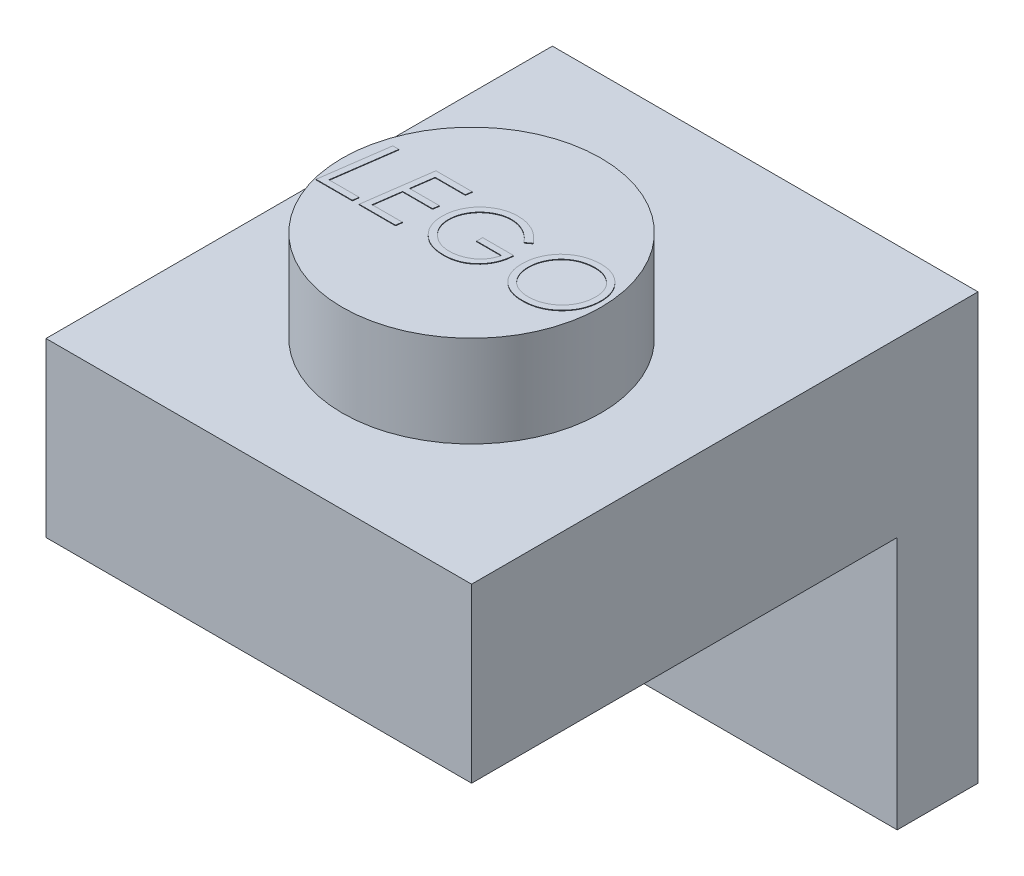
from build123d import *

# Parameters (mm, degrees)
SKETCH1_W           = 7.9
SKETCH1_H           = 7.9
BOSS_EXTRUDE1_DEPTH = 3.2
SKETCH2_R           = 2.4
BOSS_EXTRUDE2_DEPTH = 1.7
BOSS_EXTRUDE4_DEPTH = 0.01
SKETCH4_W           = 6.679581062
SKETCH4_H           = 6.679581062
CUT_EXTRUDE1_DEPTH  = 2.01
BOSS_EXTRUDE5_START = -2.01
BOSS_EXTRUDE5_DEPTH = 2.01
SKETCH6_W           = 7.9
SKETCH6_H           = 7.9
BOSS_EXTRUDE6_DEPTH = 1.5
SKETCH7_R           = 2.4
BOSS_EXTRUDE7_DEPTH = 1.4
SKETCH8_R           = 1.690060404
CUT_EXTRUDE2_DEPTH  = 1.4


with BuildPart() as part:
    # Sketch1 → Boss-Extrude1 (new body)
    with BuildSketch(Plane(origin=(0, 0, 0), x_dir=(1, 0, 0), z_dir=(0, 1, 0))):
        with Locations((3.95, 3.95)):
            Rectangle(SKETCH1_W, SKETCH1_H)
    extrude(amount=BOSS_EXTRUDE1_DEPTH)

    # Sketch2 → Boss-Extrude2 (add)
    with BuildSketch(Plane(origin=(0, 3.2, 0), x_dir=(1, 0, 0), z_dir=(0, 1, 0))):
        with Locations(Location((3.95, 3.95, 0), (0, 0, 270))):
            Circle(SKETCH2_R)
    extrude(amount=BOSS_EXTRUDE2_DEPTH)

    # Sketch3 → Boss-Extrude4 (add)
    # profile 1 of 4: a face of its own
    with BuildSketch(Plane(origin=(0, 4.9, 0), x_dir=(1, 0, 0), z_dir=(0, 1, 0))):
        Polygon((1.832282536, 4.604898123), (1.945463626, 4.604898123), (1.785708017, 3.46707761), (2.346104652, 3.46707761), (2.331831815, 3.354898123), (1.657002088, 3.354898123), align=None)
    # profile 2 of 4: a face of its own
    with BuildSketch(Plane(origin=(0, 4.9, 0), x_dir=(1, 0, 0), z_dir=(0, 1, 0))):
        Polygon((3.307643113, 4.604898123), (3.289864668, 4.492718636), (2.730720036, 4.492718636), (2.672376687, 4.076051969), (3.227514908, 4.076051969), (3.211489267, 3.963872482), (2.656351046, 3.963872482), (2.586990069, 3.46707761), (3.147386703, 3.46707761), (3.132863466, 3.354898123), (2.458284139, 3.354898123), (2.633564588, 4.604898123), align=None)
    # profile 3 of 4: a face of its own
    with BuildSketch(Plane(origin=(0, 4.9, 0), x_dir=(1, 0, 0), z_dir=(0, 1, 0))):
        with BuildLine():
            Line((4.701873883, 4.341727049), (4.602214428, 4.268359661))
            add(Edge.make_bspline(
                [(4.602214428, 4.268359661), (4.594223081, 4.278463296), (4.578382454, 4.298490949), (4.552974208, 4.326751799), (4.526781942, 4.353389692), (4.49925824, 4.377917229), (4.471083571, 4.40112998), (4.441525281, 4.42204341), (4.410978563, 4.441207159), (4.379659496, 4.458649755), (4.347610579, 4.474125482), (4.315396207, 4.487732834), (4.282869127, 4.498922357), (4.250283005, 4.50864136), (4.217299487, 4.51587276), (4.18414763, 4.520710487), (4.150903008, 4.524293062), (4.128633082, 4.524610402), (4.117438786, 4.524769918)],
                knots=[0, 0, 0, 0, 1.088205139, 2.157064813, 3.209299296, 4.24303109, 5.270682624, 6.292193363, 7.299904734, 8.316436989, 9.319473328, 10.305733085, 11.269264382, 12.22444877, 13.177574148, 14.119122834, 15.054550362, 16, 16, 16, 16], degree=3))
            add(Edge.make_bspline(
                [(4.117438786, 4.524769918), (4.104994375, 4.524521107), (4.080132736, 4.524024028), (4.043033101, 4.520256885), (4.006376299, 4.51354748), (3.969908323, 4.504926578), (3.933893833, 4.493301772), (3.898252767, 4.479273564), (3.86309309, 4.462612711), (3.828430169, 4.443710217), (3.794953431, 4.422557236), (3.762954424, 4.399818018), (3.733183783, 4.375017311), (3.704650221, 4.34913067), (3.678490591, 4.320990985), (3.654040353, 4.291325456), (3.631570613, 4.259970376), (3.610753816, 4.22729124), (3.592321888, 4.193377608), (3.576332398, 4.158696131), (3.562301633, 4.123622124), (3.551463822, 4.087613068), (3.542488613, 4.051135011), (3.536702509, 4.013925289), (3.532682003, 3.976230124), (3.532229884, 3.950862463), (3.532002088, 3.938081216)],
                knots=[0, 0, 0, 0, 0.97704485, 1.95195533, 2.923843304, 3.901415526, 4.89212417, 5.89249681, 6.906854198, 7.94508701, 8.99059592, 10.014519948, 11.024825533, 12.031297736, 13.037428488, 14.038509295, 15.047964276, 16.064309815, 17.079005887, 18.075937854, 19.061713623, 20.042247028, 21.026191147, 22.008802999, 22.996754876, 24, 24, 24, 24], degree=3))
            add(Edge.make_bspline(
                [(3.532002088, 3.938081216), (3.532369323, 3.920940483), (3.533092921, 3.887166428), (3.54080397, 3.83756171), (3.552297071, 3.789703796), (3.569345009, 3.743984102), (3.590663785, 3.700113704), (3.616898701, 3.658340736), (3.647995923, 3.618632516), (3.683169388, 3.581124089), (3.721975609, 3.547190184), (3.762989457, 3.517071082), (3.806208637, 3.491553815), (3.851780792, 3.471217023), (3.899058754, 3.454481236), (3.948703848, 3.443615036), (4.000192874, 3.436168993), (4.035279814, 3.435410998), (4.053085822, 3.435026328)],
                knots=[0, 0, 0, 0, 1.019699772, 2.00921373, 2.981850619, 3.945611549, 4.907936516, 5.881372837, 6.876399243, 7.906447893, 8.938173367, 9.941073143, 10.932270214, 11.919723139, 12.908225854, 13.912405215, 14.940582182, 16, 16, 16, 16], degree=3))
            add(Edge.make_bspline(
                [(4.053085822, 3.435026328), (4.074581254, 3.435599426), (4.11748625, 3.436743331), (4.180872469, 3.447608002), (4.243162184, 3.464003995), (4.303115661, 3.48756372), (4.359892332, 3.516274774), (4.411741714, 3.54979345), (4.457784869, 3.587961635), (4.498384943, 3.630580026), (4.53303885, 3.678554542), (4.563120551, 3.731230233), (4.587740602, 3.789373269), (4.599634966, 3.830601123), (4.605720036, 3.851692995)],
                knots=[0, 0, 0, 0, 1.033792167, 2.063454529, 3.086685911, 4.12966393, 5.157365104, 6.144632769, 7.094686579, 8.02963692, 8.969786061, 9.935985671, 10.944065236, 12, 12, 12, 12], degree=3))
            Line((4.605720036, 3.851692995), (4.140976447, 3.851692995))
            Line((4.140976447, 3.851692995), (4.140976447, 3.963872482))
            Line((4.140976447, 3.963872482), (4.717899524, 3.963872482))
            add(Edge.make_bspline(
                [(4.717899524, 3.963872482), (4.715864452, 3.940537279), (4.711874195, 3.894782885), (4.69942647, 3.828086612), (4.68199329, 3.764774229), (4.659173945, 3.704861641), (4.630919519, 3.648505742), (4.59774963, 3.595348644), (4.559285746, 3.545571633), (4.515814341, 3.499721655), (4.46844757, 3.458302738), (4.417878433, 3.421925394), (4.364351012, 3.391393009), (4.308182236, 3.366007973), (4.248908241, 3.346854494), (4.187007442, 3.33278705), (4.12217798, 3.324364805), (4.078067373, 3.323359246), (4.055589828, 3.322846841)],
                knots=[0, 0, 0, 0, 1.098006248, 2.152910829, 3.176693714, 4.174102283, 5.154427425, 6.128677043, 7.108165613, 8.099464247, 9.087077226, 10.054952015, 11.015803916, 11.972468591, 12.940477937, 13.931877037, 14.946141749, 16, 16, 16, 16], degree=3))
            add(Edge.make_bspline(
                [(4.055589828, 3.322846841), (4.032525547, 3.323342362), (3.987411429, 3.324311611), (3.9214857, 3.332876212), (3.858807865, 3.34620412), (3.799404334, 3.365318809), (3.743277296, 3.389857102), (3.690679177, 3.420179827), (3.641268759, 3.455657405), (3.595689928, 3.496348401), (3.554559756, 3.541197331), (3.518567584, 3.589307242), (3.487743642, 3.639999747), (3.462901044, 3.693721351), (3.443468533, 3.750181555), (3.429856098, 3.809437188), (3.421311108, 3.871476007), (3.420325278, 3.913764014), (3.419822601, 3.935326809)],
                knots=[0, 0, 0, 0, 1.117903688, 2.186638197, 3.21780727, 4.221242465, 5.20706516, 6.182431358, 7.159609539, 8.151436913, 9.139682433, 10.10533578, 11.060397566, 12.011007066, 12.969638005, 13.950363306, 14.954883424, 16, 16, 16, 16], degree=3))
            add(Edge.make_bspline(
                [(3.419822601, 3.935326809), (3.420138952, 3.950859376), (3.420767729, 3.981731803), (3.424963713, 4.027616327), (3.432679126, 4.072646659), (3.442852825, 4.116910735), (3.455965552, 4.160496846), (3.471933961, 4.20328178), (3.491087489, 4.245242481), (3.513047729, 4.286115161), (3.537530339, 4.325600602), (3.564271155, 4.363247138), (3.593498243, 4.398542313), (3.624507556, 4.432098501), (3.658146201, 4.463054417), (3.693847346, 4.491888255), (3.731480716, 4.518905381), (3.77142415, 4.543221398), (3.812846375, 4.565137356), (3.855118915, 4.584605211), (3.898469674, 4.600573637), (3.942428974, 4.613905323), (3.987291028, 4.624144078), (4.032916476, 4.631801844), (4.079465257, 4.63599767), (4.110753822, 4.636631416), (4.12645321, 4.636949405)],
                knots=[0, 0, 0, 0, 1.01034602, 2.008157081, 2.993527994, 3.979930372, 4.960683832, 5.951959865, 6.948100503, 7.958563211, 8.967975239, 9.968308804, 10.959584837, 11.946808627, 12.938010319, 13.930059161, 14.930392727, 15.949048275, 16.969091794, 17.977364349, 18.973726886, 19.971641333, 20.963333569, 21.964771492, 22.978801278, 24, 24, 24, 24], degree=3))
            add(Edge.make_bspline(
                [(4.12645321, 4.636949405), (4.140647989, 4.63666956), (4.168739982, 4.636115737), (4.210476499, 4.63288549), (4.251380819, 4.627152534), (4.29129634, 4.618801418), (4.330484053, 4.608567941), (4.368675988, 4.59577053), (4.406070924, 4.580754735), (4.442474857, 4.563343269), (4.478143584, 4.543914061), (4.512619765, 4.521658579), (4.546625807, 4.497640881), (4.579591338, 4.471153536), (4.611552577, 4.442077414), (4.642675265, 4.410871755), (4.673242279, 4.377555225), (4.692243855, 4.353777591), (4.701873883, 4.341727049)],
                knots=[0, 0, 0, 0, 1.015105213, 2.008930748, 2.991454354, 3.966534974, 4.923490216, 5.886087319, 6.844809209, 7.803252371, 8.770243484, 9.747130909, 10.735853235, 11.746297741, 12.768902994, 13.824016992, 14.897208497, 16, 16, 16, 16], degree=3))
        make_face()
    # profile 4 of 4: a face of its own
    with BuildSketch(Plane(origin=(0, 4.9, 0), x_dir=(1, 0, 0), z_dir=(0, 1, 0))):
        with BuildLine():
            add(Edge.make_bspline(
                [(5.671925966, 4.636949405), (5.692400623, 4.63650345), (5.732667893, 4.635626396), (5.791703582, 4.627669814), (5.84816478, 4.614697282), (5.901922783, 4.596339067), (5.953136821, 4.572927607), (6.001690741, 4.544284414), (6.047399306, 4.510158163), (6.09025375, 4.471611385), (6.129154607, 4.429051867), (6.163160058, 4.383201547), (6.192058383, 4.334734533), (6.215910086, 4.283554512), (6.233823478, 4.229366588), (6.246743033, 4.172603876), (6.255145963, 4.113110877), (6.255950492, 4.072491917), (6.256361062, 4.051763107)],
                knots=[0, 0, 0, 0, 1.061681398, 2.087996504, 3.083659545, 4.062660971, 5.02945529, 5.999994507, 6.981138296, 7.983640916, 8.985844288, 9.966988076, 10.939736476, 11.908342154, 12.890058995, 13.894159216, 14.925339913, 16, 16, 16, 16], degree=3))
            add(Edge.make_bspline(
                [(6.256361062, 4.051763107), (6.25623821, 4.038988627), (6.255995471, 4.01374805), (6.253408976, 3.976225127), (6.249128591, 3.939561124), (6.243455349, 3.903597875), (6.235835613, 3.868539787), (6.226924527, 3.834140064), (6.216051359, 3.800598383), (6.20384118, 3.767696929), (6.189792262, 3.735595516), (6.173946521, 3.704324105), (6.15669213, 3.673663515), (6.137607818, 3.643838863), (6.11686312, 3.614849105), (6.094393683, 3.586665409), (6.070489857, 3.559187301), (6.044887258, 3.532733386), (6.018336956, 3.507212599), (5.990529993, 3.48355884), (5.962091012, 3.461350566), (5.932834084, 3.440746086), (5.90250067, 3.422121085), (5.871581935, 3.404690573), (5.839905885, 3.388861691), (5.807185809, 3.375183309), (5.773789823, 3.362832151), (5.739620564, 3.352089492), (5.704582969, 3.343076229), (5.668762424, 3.335500733), (5.632062087, 3.329787275), (5.594535036, 3.325855801), (5.556279304, 3.323200874), (5.530454147, 3.322965537), (5.51742877, 3.322846841)],
                knots=[0, 0, 0, 0, 1.057694632, 2.089855924, 3.112648636, 4.113725536, 5.103331559, 6.082381806, 7.055068159, 8.021768845, 8.98743121, 9.954922249, 10.923671581, 11.89959402, 12.885451751, 13.874212627, 14.883322035, 15.900071676, 16.921812937, 17.931632203, 18.921551953, 19.909055848, 20.892997665, 21.867769094, 22.84762411, 23.823252803, 24.802912784, 25.795362855, 26.787788858, 27.797679081, 28.826061376, 29.861826465, 30.921574152, 32, 32, 32, 32], degree=3))
            add(Edge.make_bspline(
                [(5.51742877, 3.322846841), (5.495540081, 3.323312388), (5.45279647, 3.324221496), (5.390401025, 3.331753811), (5.331466149, 3.34468508), (5.275615882, 3.361975519), (5.223270197, 3.38492417), (5.174339628, 3.412892082), (5.128783581, 3.445910526), (5.086763869, 3.483632016), (5.049135515, 3.525626819), (5.016044394, 3.570822838), (4.988418107, 3.619388761), (4.96538613, 3.670881503), (4.948106883, 3.725740589), (4.935156589, 3.783416472), (4.927613141, 3.844314319), (4.926699871, 3.88597706), (4.926232857, 3.907281937)],
                knots=[0, 0, 0, 0, 1.121422378, 2.189881799, 3.214223923, 4.209829567, 5.180887389, 6.136870002, 7.092517675, 8.058664933, 9.02481219, 9.976998316, 10.923432162, 11.882748215, 12.86205079, 13.865508147, 14.908495107, 16, 16, 16, 16], degree=3))
            add(Edge.make_bspline(
                [(4.926232857, 3.907281937), (4.92651465, 3.92390256), (4.927073619, 3.956871533), (4.931757127, 4.005792823), (4.939128338, 4.053761359), (4.950024433, 4.100549976), (4.963594459, 4.14639076), (4.979990494, 4.191253803), (5.000003008, 4.234848241), (5.022452359, 4.277389438), (5.047513645, 4.318359564), (5.07559856, 4.356880644), (5.105216605, 4.393691441), (5.137816677, 4.42780852), (5.172496353, 4.459796588), (5.209524734, 4.489546335), (5.248906172, 4.516814917), (5.290422211, 4.541753927), (5.333531205, 4.564369022), (5.378335052, 4.583562961), (5.424193072, 4.600182058), (5.471345954, 4.613795807), (5.519847317, 4.623918047), (5.569406413, 4.631466127), (5.620254649, 4.636113027), (5.6545551, 4.636668231), (5.671925966, 4.636949405)],
                knots=[0, 0, 0, 0, 1.027038055, 2.037251559, 3.03463374, 4.024476576, 5.003805404, 5.987972729, 6.973761106, 7.966047439, 8.95963362, 9.938921687, 10.910571097, 11.877553313, 12.852319973, 13.824735949, 14.81069978, 15.81041387, 16.816403723, 17.816876174, 18.82042938, 19.829469955, 20.847307225, 21.880377804, 22.926554263, 24, 24, 24, 24], degree=3))
        make_face()
        with BuildLine():
            add(Edge.make_bspline(
                [(5.671925966, 4.524769918), (5.65697579, 4.524545747), (5.627444828, 4.524102944), (5.583747158, 4.520086709), (5.541191397, 4.514393729), (5.499970629, 4.505322476), (5.459846772, 4.494612055), (5.421182876, 4.480527241), (5.383524652, 4.464643931), (5.34726264, 4.446055377), (5.312516644, 4.425361321), (5.279529586, 4.402463835), (5.248469657, 4.377453479), (5.219370347, 4.350164922), (5.191739723, 4.321307483), (5.166361885, 4.289965789), (5.142845474, 4.256628787), (5.121196386, 4.221501346), (5.10164712, 4.185107003), (5.08492909, 4.147719282), (5.070612165, 4.109847114), (5.058744989, 4.071497155), (5.049737471, 4.032481304), (5.043287884, 3.99291855), (5.039049877, 3.95269661), (5.03862585, 3.92565532), (5.038412344, 3.912039549)],
                knots=[0, 0, 0, 0, 1.093710758, 2.16039807, 3.20900896, 4.233234191, 5.246749975, 6.245527847, 7.241594159, 8.235879922, 9.224691631, 10.198908654, 11.171861231, 12.139893662, 13.116290872, 14.093089164, 15.087825051, 16.099756899, 17.110766713, 18.108591704, 19.094380672, 20.071961556, 21.043859171, 22.021859724, 23.00397114, 24, 24, 24, 24], degree=3))
            add(Edge.make_bspline(
                [(5.038412344, 3.912039549), (5.038625982, 3.900599914), (5.039049193, 3.877938292), (5.041777549, 3.844392517), (5.046595514, 3.811801965), (5.053065301, 3.780081073), (5.061542906, 3.749273697), (5.072183234, 3.719394567), (5.084405544, 3.690349568), (5.098393626, 3.662290632), (5.114175341, 3.635553687), (5.131389377, 3.61020951), (5.150226394, 3.586682218), (5.170360361, 3.564729612), (5.191972025, 3.544421151), (5.214980987, 3.52555365), (5.239648771, 3.508615875), (5.265465573, 3.492943288), (5.292687864, 3.479247808), (5.321165948, 3.467438697), (5.350786278, 3.457432665), (5.381544214, 3.449135171), (5.413524888, 3.442928532), (5.44663118, 3.438448028), (5.480905707, 3.435639812), (5.504152208, 3.435232585), (5.515926367, 3.435026328)],
                knots=[0, 0, 0, 0, 1.083699529, 2.146780792, 3.185591126, 4.202843058, 5.211856999, 6.209655863, 7.20532214, 8.195415879, 9.177202942, 10.14436246, 11.095191523, 12.029705806, 12.963818608, 13.902338257, 14.845476191, 15.796042213, 16.761390084, 17.729066592, 18.714222808, 19.721158958, 20.74459932, 21.797962164, 22.884686177, 24, 24, 24, 24], degree=3))
            add(Edge.make_bspline(
                [(5.515926367, 3.435026328), (5.530044188, 3.435228857), (5.558004277, 3.435629962), (5.599524853, 3.440000997), (5.64032433, 3.445959686), (5.680325762, 3.455225454), (5.71965402, 3.466535035), (5.757982705, 3.481070895), (5.795756024, 3.497476377), (5.83237428, 3.51683082), (5.867802238, 3.538111172), (5.901266528, 3.561837848), (5.932774032, 3.587459191), (5.962816859, 3.614626895), (5.990234918, 3.644356353), (6.016009711, 3.675809964), (6.039684501, 3.709331455), (6.061465654, 3.744601276), (6.080935982, 3.781209824), (6.097718361, 3.818903041), (6.112024773, 3.857287248), (6.123844079, 3.896320217), (6.132886835, 3.936161865), (6.139301688, 3.976648339), (6.14355343, 4.017951988), (6.143970816, 4.04574289), (6.144181575, 4.059775927)],
                knots=[0, 0, 0, 0, 1.029812959, 2.039525905, 3.043952503, 4.036919093, 5.033391511, 6.027870106, 7.026035071, 8.036794627, 9.047957848, 10.039952554, 11.027355318, 12.010276797, 12.992858524, 13.975534638, 14.976019862, 15.985163142, 16.99876328, 17.999396818, 18.993875413, 19.986244033, 20.973271002, 21.972624612, 22.976275263, 24, 24, 24, 24], degree=3))
            add(Edge.make_bspline(
                [(6.144181575, 4.059775927), (6.143688983, 4.077993105), (6.142724583, 4.113658826), (6.13551886, 4.16576722), (6.122807184, 4.214771606), (6.105892747, 4.261149785), (6.083400704, 4.304354629), (6.056090597, 4.344736825), (6.024020374, 4.382453222), (5.999069145, 4.404451295), (5.986429171, 4.415595238)],
                knots=[0, 0, 0, 0, 1.085318323, 2.124844004, 3.126009127, 4.096923137, 5.060061729, 6.020100862, 6.997008382, 8, 8, 8, 8], degree=3))
            add(Edge.make_bspline(
                [(5.986429171, 4.415595238), (5.97539623, 4.42431843), (5.953439426, 4.44167857), (5.917982347, 4.463870828), (5.881057133, 4.482788681), (5.842389242, 4.498145486), (5.802091847, 4.510165945), (5.760106575, 4.518646998), (5.716539836, 4.523741692), (5.686963766, 4.524423338), (5.671925966, 4.524769918)],
                knots=[0, 0, 0, 0, 0.992364662, 1.974918139, 2.947382948, 3.917989177, 4.907989082, 5.912266894, 6.938502841, 8, 8, 8, 8], degree=3))
        make_face(mode=Mode.SUBTRACT)
    extrude(amount=BOSS_EXTRUDE4_DEPTH)

    # Sketch4 → Cut-Extrude1 (cut)
    with BuildSketch(Plane.XZ):
        with Locations((3.960209469, -3.960209469)):
            Rectangle(SKETCH4_W, SKETCH4_H)
    extrude(amount=-CUT_EXTRUDE1_DEPTH, mode=Mode.SUBTRACT)

    # Sketch5 → Boss-Extrude5 (add)
    with BuildSketch(Plane(origin=(0, 3.2, 0), x_dir=(1, 0, 0), z_dir=(0, 1, 0)).offset(BOSS_EXTRUDE5_START)):
        with BuildLine():
            Line((6.369527619, 1.557811677), (5.363437843, 1.557811677))
            ThreePointArc((5.363437843, 1.557811677), (6.369527619, 0.551721901), (7.375617394, 1.557811677))
            ThreePointArc((7.375617394, 1.557811677), (7.080940521, 2.269224579), (6.369527619, 2.563901452))
            Line((6.369527619, 2.563901452), (6.369527619, 1.557811677))
        make_face()
        with BuildLine():
            Line((1.458127833, 2.579758881), (1.458127833, 1.557811677))
            Line((1.458127833, 1.557811677), (2.480075037, 1.557811677))
            ThreePointArc((2.480075037, 1.557811677), (2.180753631, 2.280437475), (1.458127833, 2.579758881))
        make_face()
        with BuildLine():
            Line((2.480075037, 1.557811677), (1.458127833, 1.557811677))
            Line((1.458127833, 1.557811677), (1.458127833, 2.579758881))
            ThreePointArc((1.458127833, 2.579758881), (0.735502035, 0.835185879), (2.480075037, 1.557811677))
        make_face()
        with BuildLine():
            ThreePointArc((5.605437996, 2.21232194), (5.425875301, 1.906719887), (5.363437843, 1.557811677))
            Line((5.363437843, 1.557811677), (6.369527619, 1.557811677))
            Line((6.369527619, 1.557811677), (6.369527619, 2.563901452))
            ThreePointArc((6.369527619, 2.563901452), (6.015263465, 2.499466361), (5.706377057, 2.31441459))
            ThreePointArc((5.706377057, 2.31441459), (5.656671092, 2.262613327), (5.605437996, 2.21232194))
        make_face()
        with BuildLine():
            ThreePointArc((7.385597221, 6.365232327), (6.369527619, 7.381301929), (5.353458016, 6.365232327))
            Line((5.353458016, 6.365232327), (6.369527619, 6.365232327))
            Line((6.369527619, 6.365232327), (6.369527619, 5.349162725))
            ThreePointArc((6.369527619, 5.349162725), (7.087997324, 5.646762621), (7.385597221, 6.365232327))
        make_face()
        with BuildLine():
            Line((6.369527619, 6.365232327), (5.353458016, 6.365232327))
            ThreePointArc((5.353458016, 6.365232327), (5.651057913, 5.646762621), (6.369527619, 5.349162725))
            Line((6.369527619, 5.349162725), (6.369527619, 6.365232327))
        make_face()
        with BuildLine():
            ThreePointArc((2.499242709, 6.365232327), (0.721948444, 7.101411716), (1.458127833, 5.324117451))
            Line((1.458127833, 5.324117451), (1.458127833, 6.365232327))
            Line((1.458127833, 6.365232327), (2.499242709, 6.365232327))
        make_face()
        with BuildLine():
            Line((1.458127833, 6.365232327), (1.458127833, 5.324117451))
            ThreePointArc((1.458127833, 5.324117451), (2.194307222, 5.629052938), (2.499242709, 6.365232327))
            Line((2.499242709, 6.365232327), (1.458127833, 6.365232327))
        make_face()
    extrude(amount=BOSS_EXTRUDE5_DEPTH)

    # Sketch6 → Boss-Extrude6 (add)
    with BuildSketch(Plane(origin=(0, 0, -7.9), x_dir=(-1, 0, 0), z_dir=(0, 0, -1))):
        with Locations((-3.95, -0.75)):
            Rectangle(SKETCH6_W, SKETCH6_H)
    extrude(amount=BOSS_EXTRUDE6_DEPTH)

    # Sketch7 → Boss-Extrude7 (add)
    with BuildSketch(Plane(origin=(0, 0, -9.4), x_dir=(-1, 0, 0), z_dir=(0, 0, -1))):
        with Locations((-3.95, -0.75)):
            Circle(SKETCH7_R)
    extrude(amount=BOSS_EXTRUDE7_DEPTH)

    # Sketch8 → Cut-Extrude2 (cut)
    with BuildSketch(Plane(origin=(0, 0, -10.8), x_dir=(-1, 0, 0), z_dir=(0, 0, -1))):
        with Locations((-3.95, -0.75)):
            Circle(SKETCH8_R)
    extrude(amount=-CUT_EXTRUDE2_DEPTH, mode=Mode.SUBTRACT)


solid = part.part
